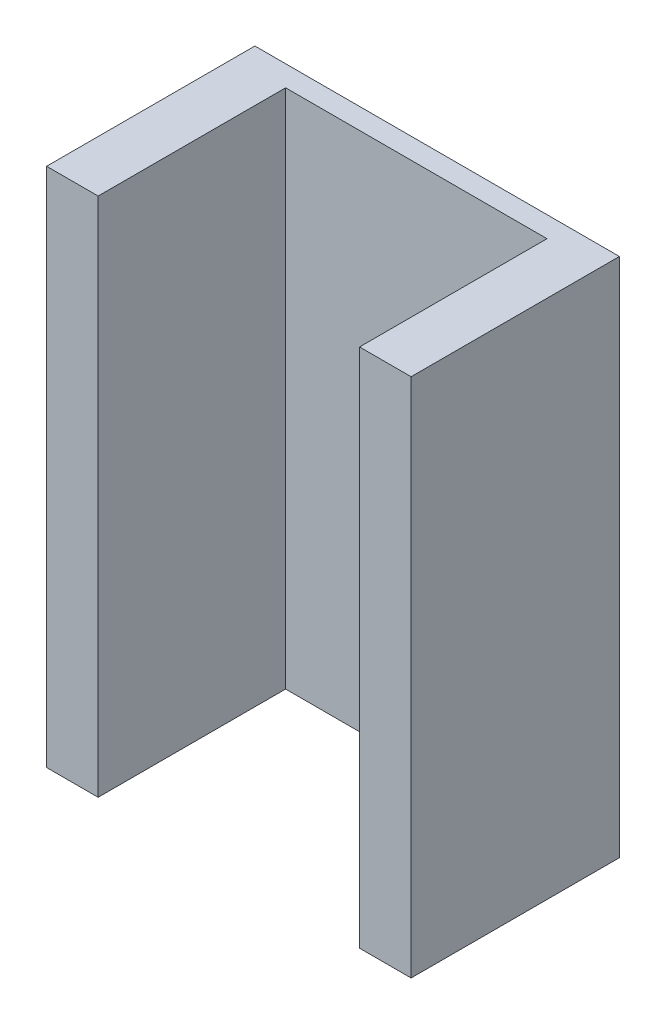
from build123d import *

# Parameters (mm, degrees)
SKETCH_1_W          = 70
SKETCH_1_H          = 100
EXTRUDE_1_DEPTH     = 40
SKETCH_2_W          = 50.2
SKETCH_2_H          = 100
CUT_EXTRUDE_1_DEPTH = 36
CUT_EXTRUDE_2_REACH = 130.452
SKETCH_3_R          = 1.5
CUT_EXTRUDE_4_REACH = 129.264
SKETCH_6_R          = 0.799974648
SKETCH_6_R_2        = 0.799973527
SKETCH_6_R_3        = 0.799971754
SKETCH_6_R_4        = 0.799972464


with BuildPart() as part:
    # 草图1 → 凸台-拉伸1 (new body)
    with BuildSketch(Plane.XY):
        with Locations((35, 50)):
            Rectangle(SKETCH_1_W, SKETCH_1_H)
    extrude(amount=EXTRUDE_1_DEPTH)

    # 草图2 → 切除-拉伸1 (cut)
    with BuildSketch(Plane.XY.offset(40)):
        with Locations((35, 50)):
            Rectangle(SKETCH_2_W, SKETCH_2_H)
    extrude(amount=-CUT_EXTRUDE_1_DEPTH, mode=Mode.SUBTRACT)

    # 草图3 → 切除-拉伸2 (cut, up to next)
    with BuildSketch(Plane(origin=(0, 0, 0), x_dir=(-1, 0, 0), z_dir=(0, 0, -1)), mode=Mode.PRIVATE) as cut_extrude_2_sk1:
        with Locations((-35, 50)):
            Circle(SKETCH_3_R)
    cut_extrude_2_tool1 = extrude(cut_extrude_2_sk1.sketch, amount=-CUT_EXTRUDE_2_REACH, mode=Mode.PRIVATE) & part.part
    add(cut_extrude_2_tool1.solids().sort_by_distance((35, 50, 0))[0], mode=Mode.SUBTRACT)

    # 草图6 → 切除-拉伸4 (cut, up to next)
    with BuildSketch(Plane.XY.offset(4), mode=Mode.PRIVATE) as cut_extrude_4_sk1:
        with Locations((35.098154463, 42.913706308)):
            Circle(SKETCH_6_R)
    cut_extrude_4_tool1 = extrude(cut_extrude_4_sk1.sketch, amount=-CUT_EXTRUDE_4_REACH, mode=Mode.PRIVATE) & part.part
    # 草图6 → 切除-拉伸4 (cut, up to next)
    with BuildSketch(Plane.XY.offset(4), mode=Mode.PRIVATE) as cut_extrude_4_sk2:
        with Locations((28.096062907, 49.911346021)):
            Circle(SKETCH_6_R_2)
    cut_extrude_4_tool2 = extrude(cut_extrude_4_sk2.sketch, amount=-CUT_EXTRUDE_4_REACH, mode=Mode.PRIVATE) & part.part
    # 草图6 → 切除-拉伸4 (cut, up to next)
    with BuildSketch(Plane.XY.offset(4), mode=Mode.PRIVATE) as cut_extrude_4_sk3:
        with Locations((35.09343748, 56.91370551)):
            Circle(SKETCH_6_R_3)
    cut_extrude_4_tool3 = extrude(cut_extrude_4_sk3.sketch, amount=-CUT_EXTRUDE_4_REACH, mode=Mode.PRIVATE) & part.part
    # 草图6 → 切除-拉伸4 (cut, up to next)
    with BuildSketch(Plane.XY.offset(4), mode=Mode.PRIVATE) as cut_extrude_4_sk4:
        with Locations((42.095529036, 49.916065797)):
            Circle(SKETCH_6_R_4)
    cut_extrude_4_tool4 = extrude(cut_extrude_4_sk4.sketch, amount=-CUT_EXTRUDE_4_REACH, mode=Mode.PRIVATE) & part.part
    add(cut_extrude_4_tool1.solids().sort_by_distance((35.098154, 42.913706, 4))[0], mode=Mode.SUBTRACT)
    add(cut_extrude_4_tool2.solids().sort_by_distance((28.096063, 49.911346, 4))[0], mode=Mode.SUBTRACT)
    add(cut_extrude_4_tool3.solids().sort_by_distance((35.093437, 56.913706, 4))[0], mode=Mode.SUBTRACT)
    add(cut_extrude_4_tool4.solids().sort_by_distance((42.095529, 49.916066, 4))[0], mode=Mode.SUBTRACT)


solid = part.part
